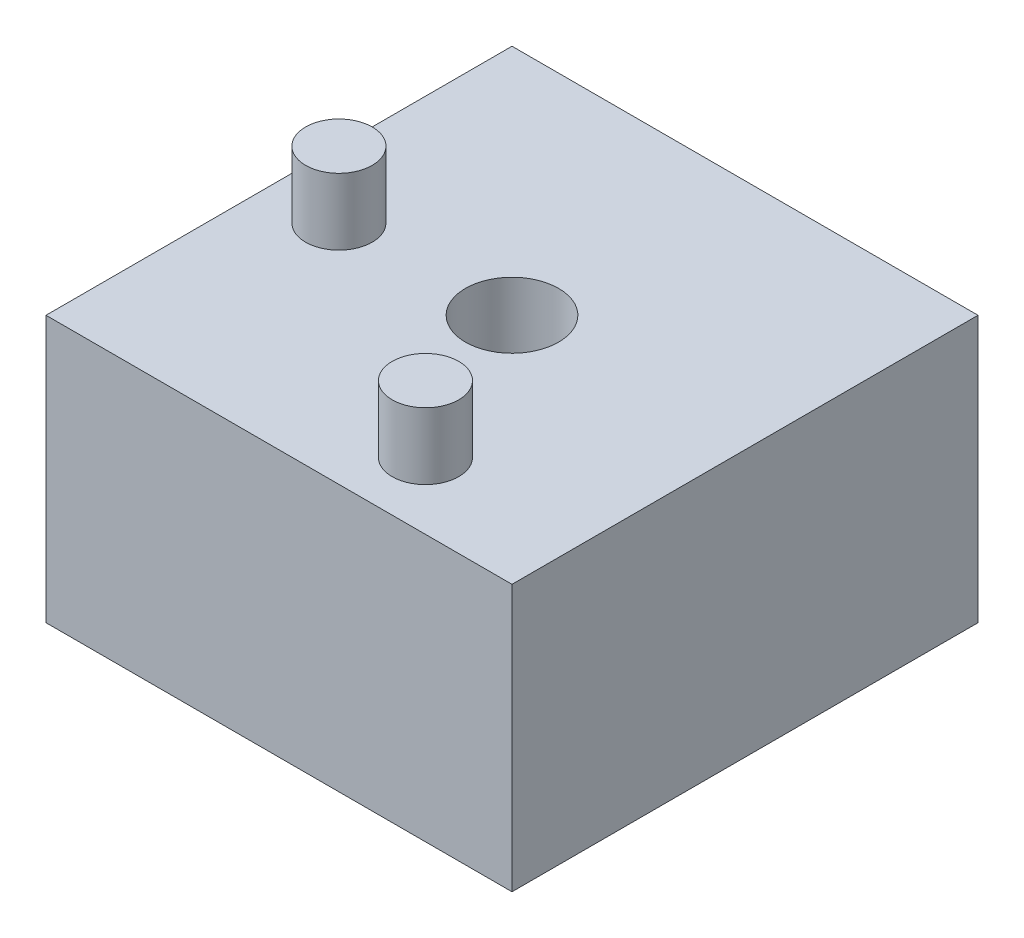
from build123d import *

# Parameters (mm, degrees)
SKETCH1_W           = 44.45
SKETCH1_H           = 44.45
BOSS_EXTRUDE1_DEPTH = 25.4
SKETCH2_R           = 3.175
BOSS_EXTRUDE2_DEPTH = 6.35
SKETCH3_R           = 2.4257
CUT_EXTRUDE1_DEPTH  = 25.4
SKETCH4_R           = 4.445
CUT_EXTRUDE2_DEPTH  = 25.4


with BuildPart() as part:
    # Sketch1 → Boss-Extrude1 (new body)
    with BuildSketch(Plane(origin=(0, 0, 0), x_dir=(1, 0, 0), z_dir=(0, 1, 0))):
        with Locations((22.225, 22.225)):
            Rectangle(SKETCH1_W, SKETCH1_H)
    extrude(amount=BOSS_EXTRUDE1_DEPTH)

    # Sketch2 → Boss-Extrude2 (add)
    with BuildSketch(Plane(origin=(0, 25.4, 0), x_dir=(1, 0, 0), z_dir=(0, 1, 0))):
        with Locations(Location((6.35, 21.59, 0), (0, 0, 270))):
            Circle(SKETCH2_R)
        with Locations(Location((29.845, 6.35, 0), (0, 0, 270))):
            Circle(SKETCH2_R)
    extrude(amount=BOSS_EXTRUDE2_DEPTH)

    # Sketch3 → Cut-Extrude1 (cut)
    with BuildSketch(Plane(origin=(0, 25.4, 0), x_dir=(1, 0, 0), z_dir=(0, 1, 0))):
        with Locations(Location((22.225, 22.225, 0), (0, 0, 270))):
            Circle(SKETCH3_R)
    extrude(amount=-CUT_EXTRUDE1_DEPTH, mode=Mode.SUBTRACT)

    # Sketch4 → Cut-Extrude2 (cut)
    with BuildSketch(Plane.XZ):
        with Locations(Location((22.225, -22.225, 0), (0, 0, 270))):
            Circle(SKETCH4_R)
    extrude(amount=-CUT_EXTRUDE2_DEPTH, mode=Mode.SUBTRACT)


solid = part.part
